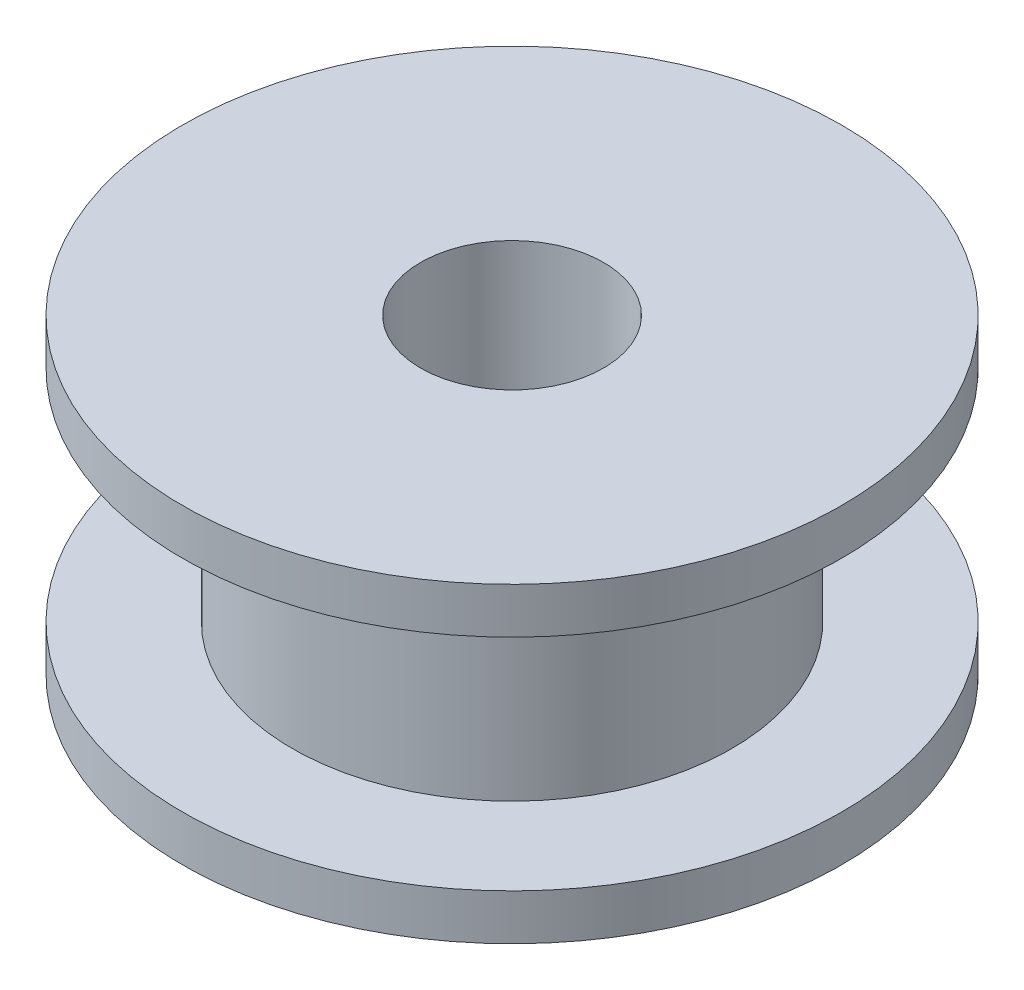
from build123d import *

# Parameters (mm, degrees)
SKETCH_2_R          = 2.5
CUT_EXTRUDE_1_DEPTH = 10


with BuildPart() as part:
    # 草图1 → 旋转1 (revolve)
    with BuildSketch(Plane.XY, mode=Mode.PRIVATE) as revolve_1_sk:
        Polygon((0, -8.5), (-9, -8.5), (-9, -7.25), (-6, -7.25), (-6, -1.25), (-9, -1.25), (-9, 0), (0, 0), align=None)
    revolve(revolve_1_sk.sketch.rotate(Axis((0, 0, 0), (0, 1, 0)), 270), axis=Axis((0, 0, 0), (0, 1, 0)))

    # 草图2 → 切除-拉伸1 (cut)
    with BuildSketch(Plane(origin=(0, 0, 0), x_dir=(1, 0, 0), z_dir=(0, 1, 0))):
        with Locations(Location((0, 0, 0), (0, 0, 270))):
            Circle(SKETCH_2_R)
    extrude(amount=-CUT_EXTRUDE_1_DEPTH, mode=Mode.SUBTRACT)


solid = part.part
